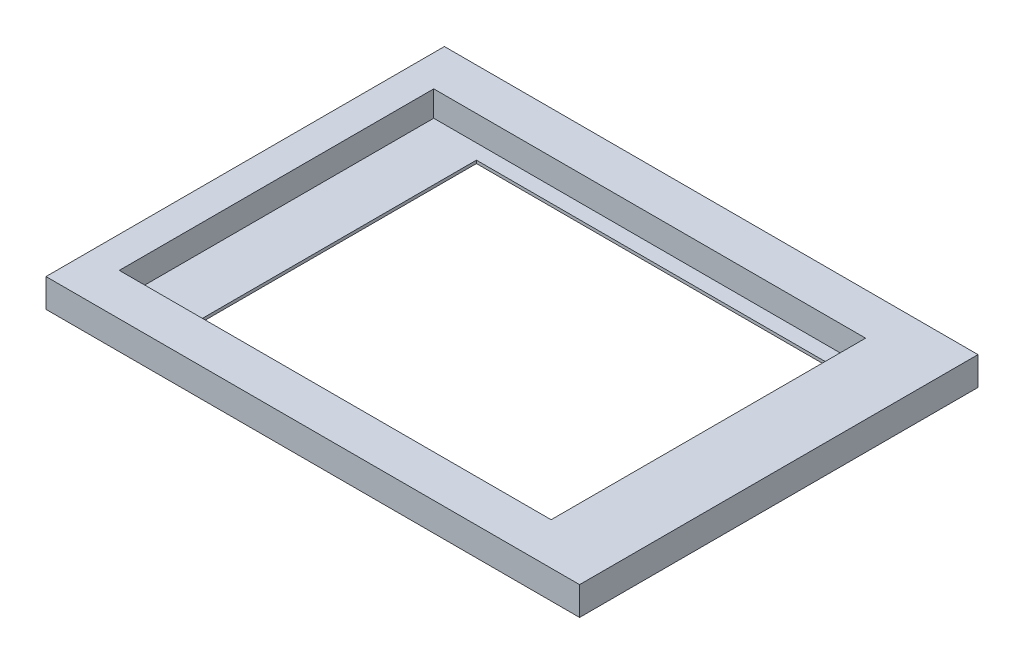
from build123d import *

# Parameters (mm, degrees)
ESBO_O4_W                = 75
ESBO_O4_H                = 56
RESSALTO_EXTRUS_O1_DEPTH = 4
ESBO_O5_W                = 50
ESBO_O5_H                = 40
CORTE_EXTRUS_O1_DEPTH    = 94.685644578
ESBO_O6_W                = 60.7
ESBO_O6_H                = 44.2
CORTE_EXTRUS_O2_DEPTH    = 3.58


with BuildPart() as part:
    # Esboço4 → Ressalto-extrusão1 (new body)
    with BuildSketch(Plane(origin=(0, 0, 0), x_dir=(1, 0, 0), z_dir=(0, 1, 0))):
        with Locations((-37.5, 28)):
            Rectangle(ESBO_O4_W, ESBO_O4_H)
    extrude(amount=RESSALTO_EXTRUS_O1_DEPTH)

    # Esboço5 → Corte-extrusão1 (cut, through all)
    with BuildSketch(Plane(origin=(0, 4, 0), x_dir=(1, 0, 0), z_dir=(0, 1, 0))):
        with Locations((-37.5, 28)):
            Rectangle(ESBO_O5_W, ESBO_O5_H)
    extrude(amount=-CORTE_EXTRUS_O1_DEPTH, mode=Mode.SUBTRACT)

    # Esboço6 → Corte-extrusão2 (cut)
    with BuildSketch(Plane(origin=(0, 4, 0), x_dir=(1, 0, 0), z_dir=(0, 1, 0))):
        with Locations((-40.25, 28)):
            Rectangle(ESBO_O6_W, ESBO_O6_H)
    extrude(amount=-CORTE_EXTRUS_O2_DEPTH, mode=Mode.SUBTRACT)


solid = part.part
